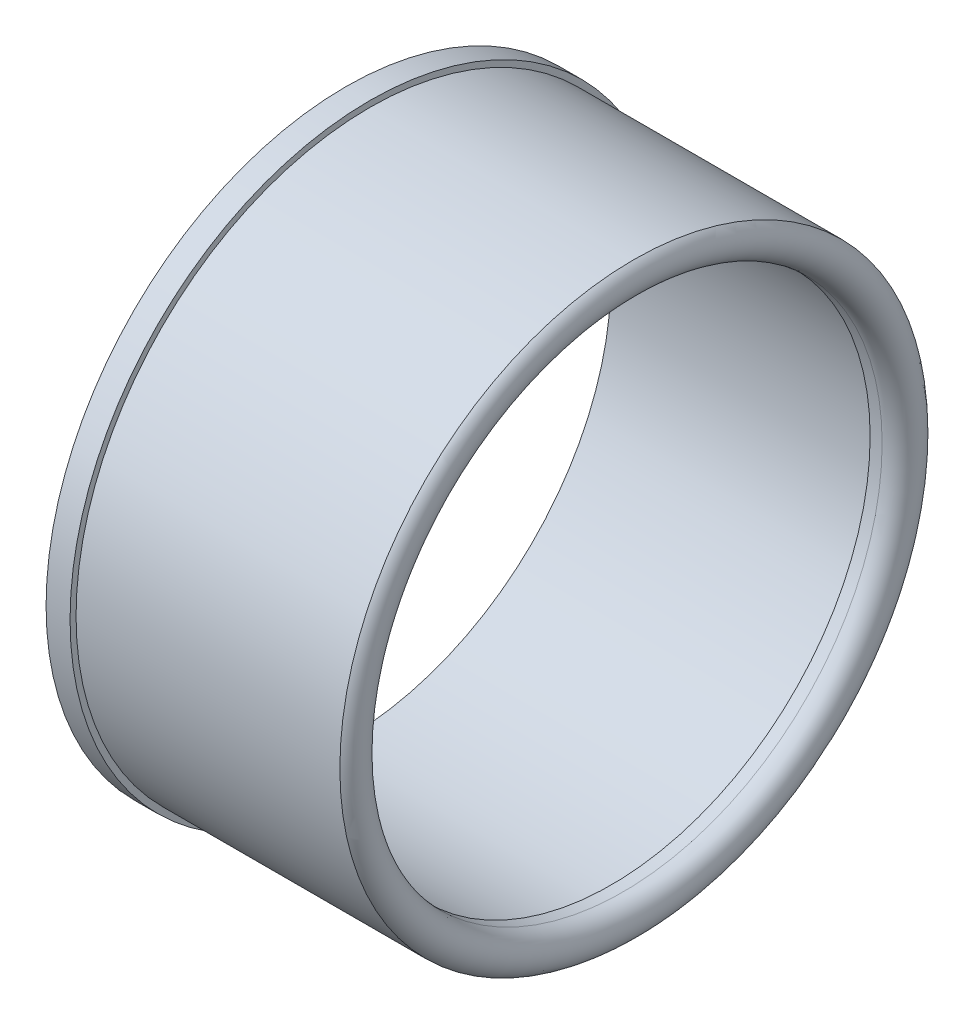
from build123d import *


with BuildPart() as part:
    # Sketch1 → Revolve1 (revolve)
    with BuildSketch(Plane(origin=(0, 0, 0), x_dir=(-1, 0, 0), z_dir=(0, 0, -1)), mode=Mode.PRIVATE) as revolve1_sk:
        with BuildLine():
            Line((-11.972812665, 2.266736765), (-11.972812665, 2.516736765))
            Line((-11.972812665, 2.516736765), (-0.912123334, 2.516736765))
            Line((-0.912123334, 2.516736765), (-0.912123334, 3.966736765))
            Line((-0.912123334, 3.966736765), (-1.912123334, 3.966736765))
            Line((-1.912123334, 3.966736765), (-1.912123334, 3.716736765))
            Line((-1.912123334, 3.716736765), (-12.912123334, 3.716736765))
            ThreePointArc((-12.912123334, 3.716736765), (-13.230357031, 2.828770979), (-12.472812665, 2.266736765))
            Line((-12.472812665, 2.266736765), (-11.972812665, 2.266736765))
        make_face()
    revolve(revolve1_sk.sketch.rotate(Axis((12.175741694, -8.533263235, 0), (-1, 0, 0)), 270), axis=Axis((12.175741694, -8.533263235, 0), (-1, 0, 0)))


solid = part.part
